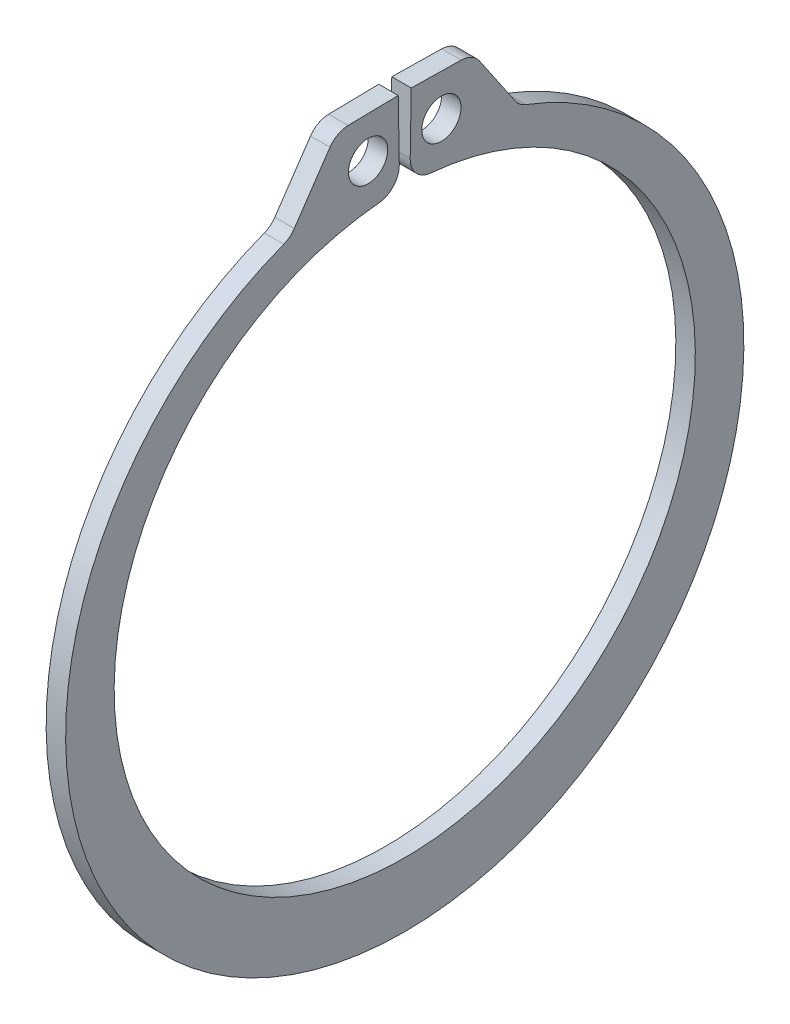
from build123d import *

# Parameters (mm, degrees)
BOSS_EXTRUDE1_DEPTH      = 0.7874
BOSS_EXTRUDE1_DEPTH_BACK = 0.7874
SKETCH3_R                = 1.5875
FILLET1_R                = 1.8161


with BuildPart() as part:
    # Sketch3 → Boss-Extrude1 (new, two sides: drawn at the far end of the back side and taken through both)
    with BuildSketch(Plane(origin=(0, 0, 0), x_dir=(0, 0, -1), z_dir=(1, 0, 0)).offset(-BOSS_EXTRUDE1_DEPTH_BACK)):
        with BuildLine():
            Line((-5.516526395, 30.058101334), (-9.254157379, 24.552061226))
            ThreePointArc((-9.254157379, 24.552061226), (0, -28.6766), (9.254157379, 24.552061226))
            Line((9.254157379, 24.552061226), (5.516526395, 30.058101334))
            Line((5.516526395, 30.058101334), (0.526186564, 30.145208039))
            Line((0.526186564, 30.145208039), (0.410044289, 23.491421598))
            ThreePointArc((0.410044289, 23.491421598), (0, -23.495), (-0.410044289, 23.491421598))
            Line((-0.410044289, 23.491421598), (-0.526186564, 30.145208039))
            Line((-0.526186564, 30.145208039), (-5.516526395, 30.058101334))
        make_face()
        with Locations((-2.963285342, 26.774761466)):
            Circle(SKETCH3_R, mode=Mode.SUBTRACT)
        with Locations((2.963285342, 26.774761466)):
            Circle(SKETCH3_R, mode=Mode.SUBTRACT)
    extrude(amount=BOSS_EXTRUDE1_DEPTH + BOSS_EXTRUDE1_DEPTH_BACK)

    # Fillet1
    fillet1_edges = [part.edges().sort_by_distance(p)[0] for p in [
        (0, 24.552061226, 9.254157379),
        (0, 30.058101334, 5.516526395),
        (0, 23.491421598, 0.410044289),
        (0, 23.491421598, -0.410044289),
        (0, 30.058101334, -5.516526395),
        (0, 24.552061226, -9.254157379),
    ]]
    fillet(fillet1_edges, radius=FILLET1_R)


solid = part.part
